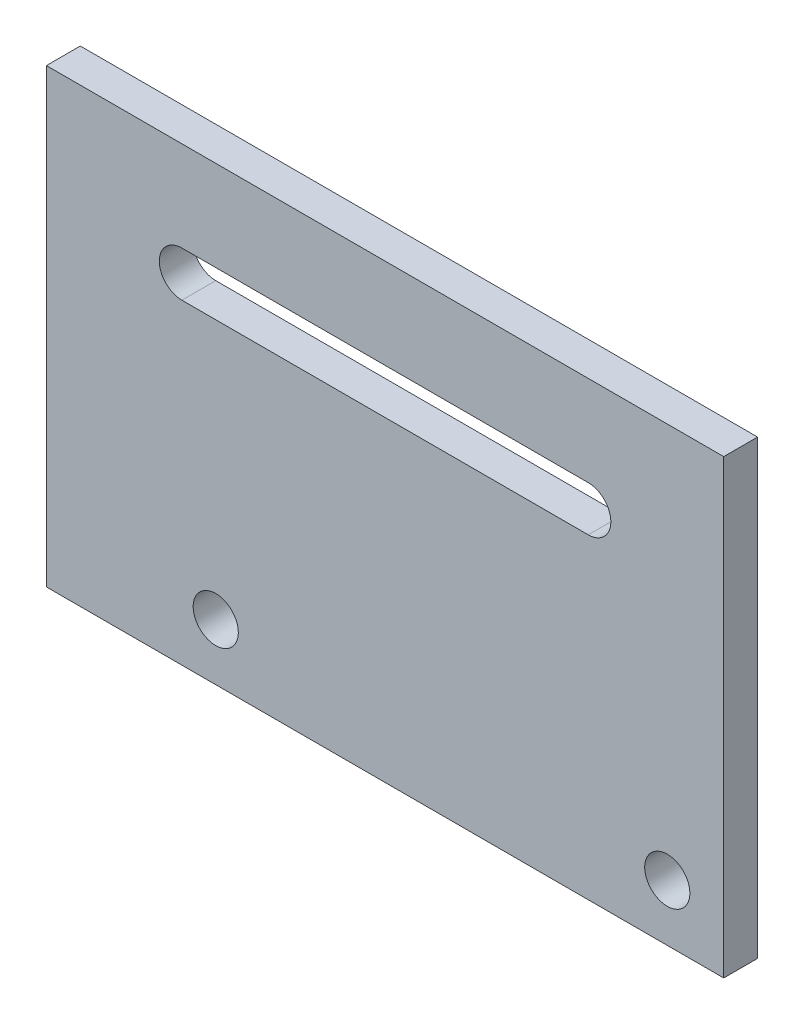
from build123d import *

# Parameters (mm, degrees)
SKETCH4_W           = 30
SKETCH4_H           = 20
SKETCH4_R           = 1
BOSS_EXTRUDE2_DEPTH = 1.5


with BuildPart() as part:
    # Sketch4 → Boss-Extrude2 (new body)
    with BuildSketch(Plane.XY):
        with Locations((2.769964864, 12.5155541)):
            Rectangle(SKETCH4_W, SKETCH4_H)
        with Locations((-4.730035136, 5.0155541)):
            Circle(SKETCH4_R, mode=Mode.SUBTRACT)
        with Locations((15.269964864, 5.0155541)):
            Circle(SKETCH4_R, mode=Mode.SUBTRACT)
        with BuildLine():
            Line((-6.230035136, 18.5155541), (11.769964864, 18.5155541))
            ThreePointArc((11.769964864, 18.5155541), (12.769964864, 17.5155541), (11.769964864, 16.5155541))
            Line((11.769964864, 16.5155541), (-6.230035136, 16.5155541))
            ThreePointArc((-6.230035136, 16.5155541), (-7.230035136, 17.5155541), (-6.230035136, 18.5155541))
        make_face(mode=Mode.SUBTRACT)
    extrude(amount=BOSS_EXTRUDE2_DEPTH)


solid = part.part
